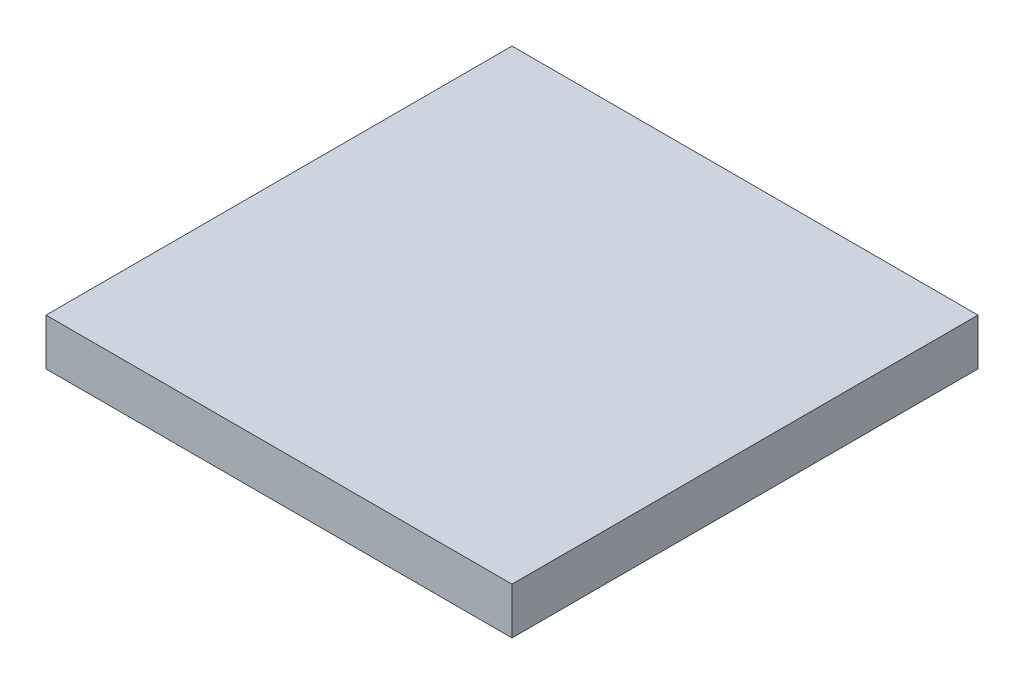
from build123d import *

# Parameters (mm, degrees)
CROQUIS1_W              = 5
CROQUIS1_H              = 5
SALIENTE_EXTRUIR1_DEPTH = 0.5


with BuildPart() as part:
    # Croquis1 → Saliente-Extruir1 (new body)
    with BuildSketch(Plane(origin=(0, 0, 0), x_dir=(1, 0, 0), z_dir=(0, 1, 0))):
        with Locations((2.5, 2.5)):
            Rectangle(CROQUIS1_W, CROQUIS1_H)
    extrude(amount=SALIENTE_EXTRUIR1_DEPTH)


solid = part.part
